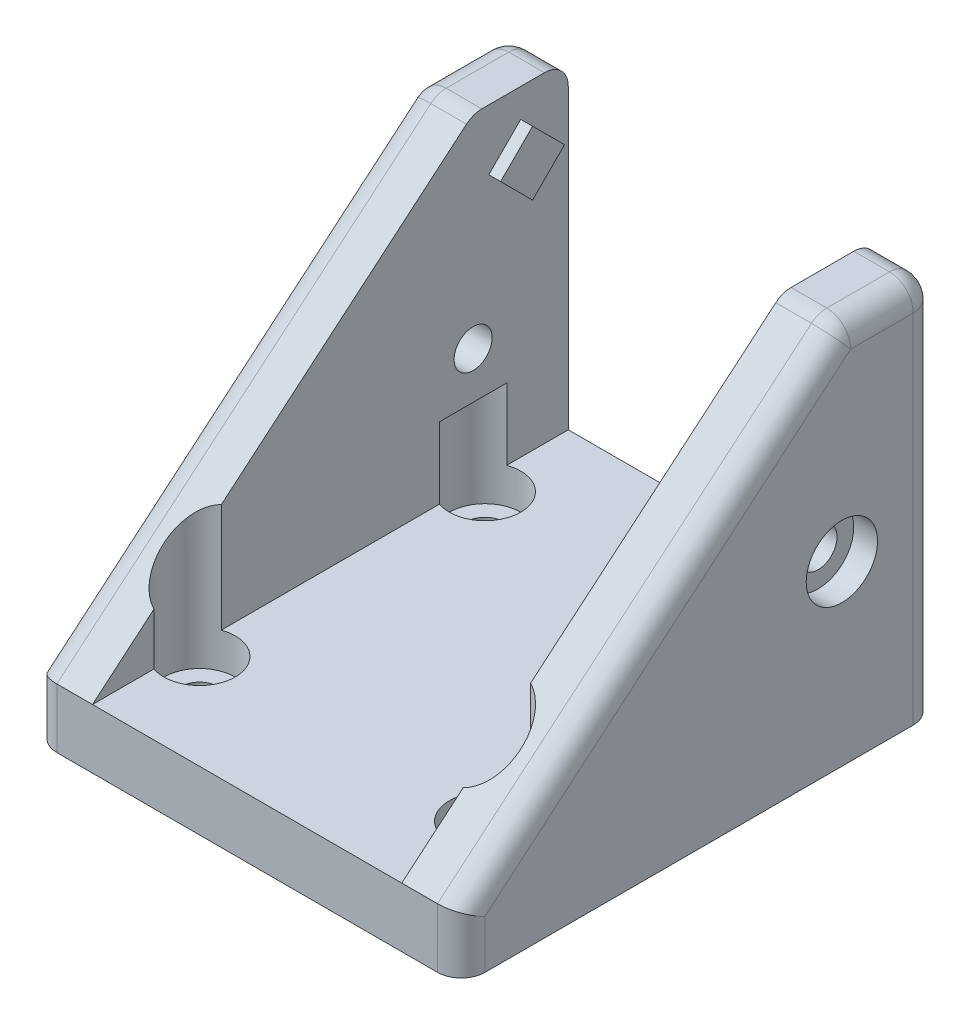
from build123d import *

# Parameters (mm, degrees)
SKETCH1_W       = 36
SKETCH1_H       = 40
EXTRUDE1_DEPTH  = 5
EXTRUDE2_DEPTH  = 5
EXTRUDE3_DEPTH  = 5
SKETCH4_R       = 3
EXTRUDE4_DEPTH  = 3
SKETCH5_R       = 1.6
EXTRUDE5_DEPTH  = 3
EXTRUDE6_START  = 6
SKETCH6_R       = 3
EXTRUDE6_DEPTH  = 6
FILLET1_R       = 2
EXTRUDE7_DEPTH  = 1
SKETCH9_R       = 1.6
EXTRUDE8_DEPTH  = 49.836461788
SKETCH10_R      = 3
EXTRUDE9_DEPTH  = 2
SKETCH11_R      = 3
EXTRUDE10_DEPTH = 39.118237105
FILLET2_R       = 2


with BuildPart() as part:
    # Sketch1 → Extrude1 (new body)
    with BuildSketch(Plane(origin=(0, 0, 0), x_dir=(1, 0, 0), z_dir=(0, 1, 0))):
        Rectangle(SKETCH1_W, SKETCH1_H)
    extrude(amount=EXTRUDE1_DEPTH)

    # Sketch2 → Extrude2 (add)
    with BuildSketch(Plane.ZY.offset(18)):
        Polygon((-20, 0), (-20, 32), (-12, 32), (20, 5), (20, 0), align=None)
    extrude(amount=-EXTRUDE2_DEPTH)

    # Sketch3 → Extrude3 (add)
    with BuildSketch(Plane(origin=(18, 0, 0), x_dir=(0, 0, -1), z_dir=(1, 0, 0))):
        Polygon((20, 0), (20, 32), (12, 32), (-20, 5), (-20, 0), align=None)
    extrude(amount=-EXTRUDE3_DEPTH)

    # Sketch4 → Extrude4 (cut)
    with BuildSketch(Plane(origin=(0, 5, 0), x_dir=(1, 0, 0), z_dir=(0, 1, 0))):
        with Locations(Location((-12, 12, 0), (0, 0, 270))):
            Circle(SKETCH4_R)
        with Locations(Location((-12, -12, 0), (0, 0, 270))):
            Circle(SKETCH4_R)
        with Locations(Location((12, 12, 0), (0, 0, 270))):
            Circle(SKETCH4_R)
        with Locations(Location((12, -12, 0), (0, 0, 270))):
            Circle(SKETCH4_R)
    extrude(amount=-EXTRUDE4_DEPTH, mode=Mode.SUBTRACT)

    # Sketch5 → Extrude5 (cut)
    with BuildSketch(Plane(origin=(0, 2, 0), x_dir=(1, 0, 0), z_dir=(0, 1, 0))):
        with Locations(Location((-12, 12, 0), (0, 0, 270))):
            Circle(SKETCH5_R)
        with Locations(Location((-12, -12, 0), (0, 0, 270))):
            Circle(SKETCH5_R)
        with Locations(Location((12, -12, 0), (0, 0, 270))):
            Circle(SKETCH5_R)
        with Locations(Location((12, 12, 0), (0, 0, 270))):
            Circle(SKETCH5_R)
    extrude(amount=-EXTRUDE5_DEPTH, mode=Mode.SUBTRACT)

    # Sketch6 → Extrude6 (cut)
    with BuildSketch(Plane(origin=(0, 5, 0), x_dir=(1, 0, 0), z_dir=(0, 1, 0)).offset(EXTRUDE6_START)):
        with Locations(Location((-12, 12, 0), (0, 0, 270))):
            Circle(SKETCH6_R)
        with Locations(Location((12, 12, 0), (0, 0, 270))):
            Circle(SKETCH6_R)
    extrude(amount=-EXTRUDE6_DEPTH, mode=Mode.SUBTRACT)

    # Fillet1
    fillet1_edges = [part.edges().sort_by_distance(p)[0] for p in [
        (-15.5, 32, -20),
        (-15.5, 32, -12),
        (15.5, 32, -20),
        (15.5, 32, -12),
    ]]
    fillet(fillet1_edges, radius=FILLET1_R)

    # Sketch7 → Extrude7 (add)
    with BuildSketch(Plane(origin=(-13, 0, 0), x_dir=(0, 0, -1), z_dir=(1, 0, 0))):
        Polygon((16, 29.600452322), (13.312994231, 26.913446553), (16, 24.226440785), (18.687005769, 26.913446553), align=None)
    extrude7 = extrude(amount=EXTRUDE7_DEPTH)

    # Sketch9 → Extrude8 (cut, through all)
    with BuildSketch(Plane(origin=(-13, 0, 0), x_dir=(0, 0, -1), z_dir=(1, 0, 0))):
        with Locations((12, 14.913446553)):
            Circle(SKETCH9_R)
    extrude8 = extrude(amount=-EXTRUDE8_DEPTH, mode=Mode.SUBTRACT)

    # Sketch10 → Extrude9 (cut)
    with BuildSketch(Plane.ZY.offset(18)):
        with Locations((-12, 14.913446553)):
            Circle(SKETCH10_R)
    extrude9 = extrude(amount=-EXTRUDE9_DEPTH, mode=Mode.SUBTRACT)

    # Mirror2: Extrude7, Extrude8, Extrude9 across plane
    add(extrude7.mirror(Plane(origin=(0, 0, 0), x_dir=(0, 0, 1), z_dir=(1, 0, 0))))
    add(extrude8.mirror(Plane(origin=(0, 0, 0), x_dir=(0, 0, 1), z_dir=(1, 0, 0))), mode=Mode.SUBTRACT)
    add(extrude9.mirror(Plane(origin=(0, 0, 0), x_dir=(0, 0, 1), z_dir=(1, 0, 0))), mode=Mode.SUBTRACT)

    # Sketch11 → Extrude10 (cut, through all)
    with BuildSketch(Plane(origin=(0, 5, 0), x_dir=(1, 0, 0), z_dir=(0, 1, 0))):
        with Locations(Location((-12, -12, 0), (0, 0, 270))):
            Circle(SKETCH11_R)
        with Locations(Location((12, -12, 0), (0, 0, 270))):
            Circle(SKETCH11_R)
    extrude(amount=EXTRUDE10_DEPTH, mode=Mode.SUBTRACT)

    # Fillet2
    fillet2_edges = [part.edges().sort_by_distance(p)[0] for p in [
        (-18, 32, -15.365512697),
        (-18, 15, -20),
        (-18, 31.414213562, -19.414213562),
        (-18, 31.87845228, -12.044427235),
        (18, 32, -15.365512697),
        (18, 15, -20),
        (18, 18.264291484, 4.279358242),
        (18, 31.414213562, -19.414213562),
        (18, 31.87845228, -12.044427235),
        (-18, 18.264291484, 4.279358242),
        (18, 2.5, 20),
        (-18, 2.5, 20),
    ]]
    fillet(fillet2_edges, radius=FILLET2_R)


solid = part.part
